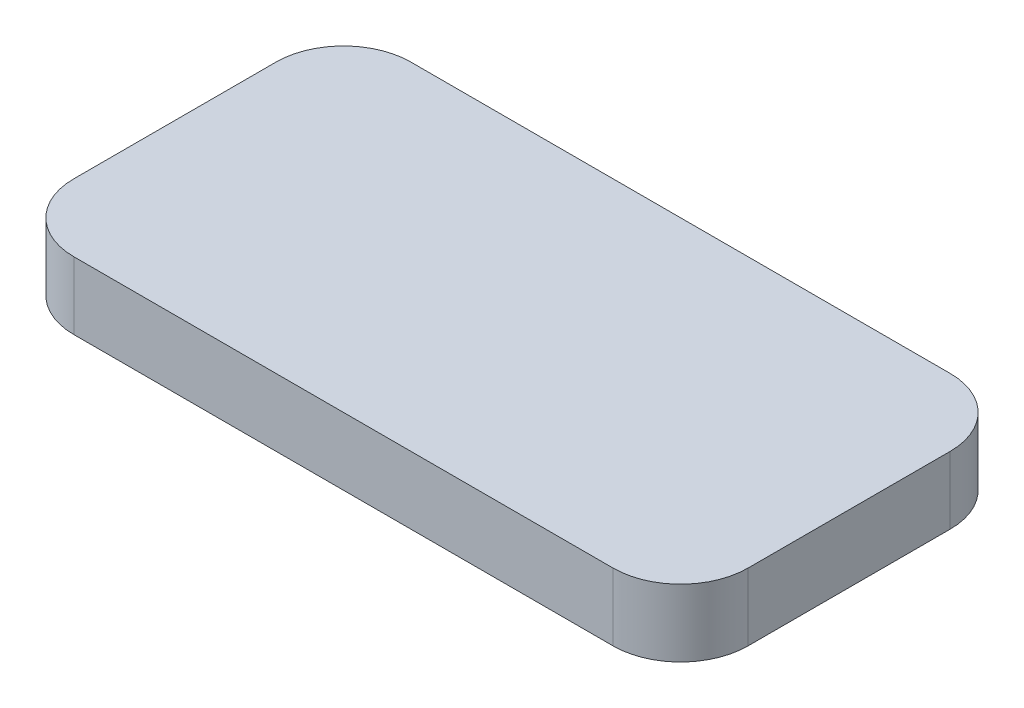
from build123d import *

# Parameters (mm, degrees)
SKETCH1_W           = 100
SKETCH1_H           = 50
BOSS_EXTRUDE1_DEPTH = 10
FILLET1_R           = 10


with BuildPart() as part:
    # Sketch1 → Boss-Extrude1 (new body)
    with BuildSketch(Plane(origin=(0, 0, 0), x_dir=(1, 0, 0), z_dir=(0, 1, 0))):
        Rectangle(SKETCH1_W, SKETCH1_H)
    extrude(amount=BOSS_EXTRUDE1_DEPTH)

    # Fillet1
    fillet1_edges = [part.edges().sort_by_distance(p)[0] for p in [
        (50, 5, 25),
        (-50, 5, 25),
        (-50, 5, -25),
        (50, 5, -25),
    ]]
    fillet(fillet1_edges, radius=FILLET1_R)


solid = part.part
